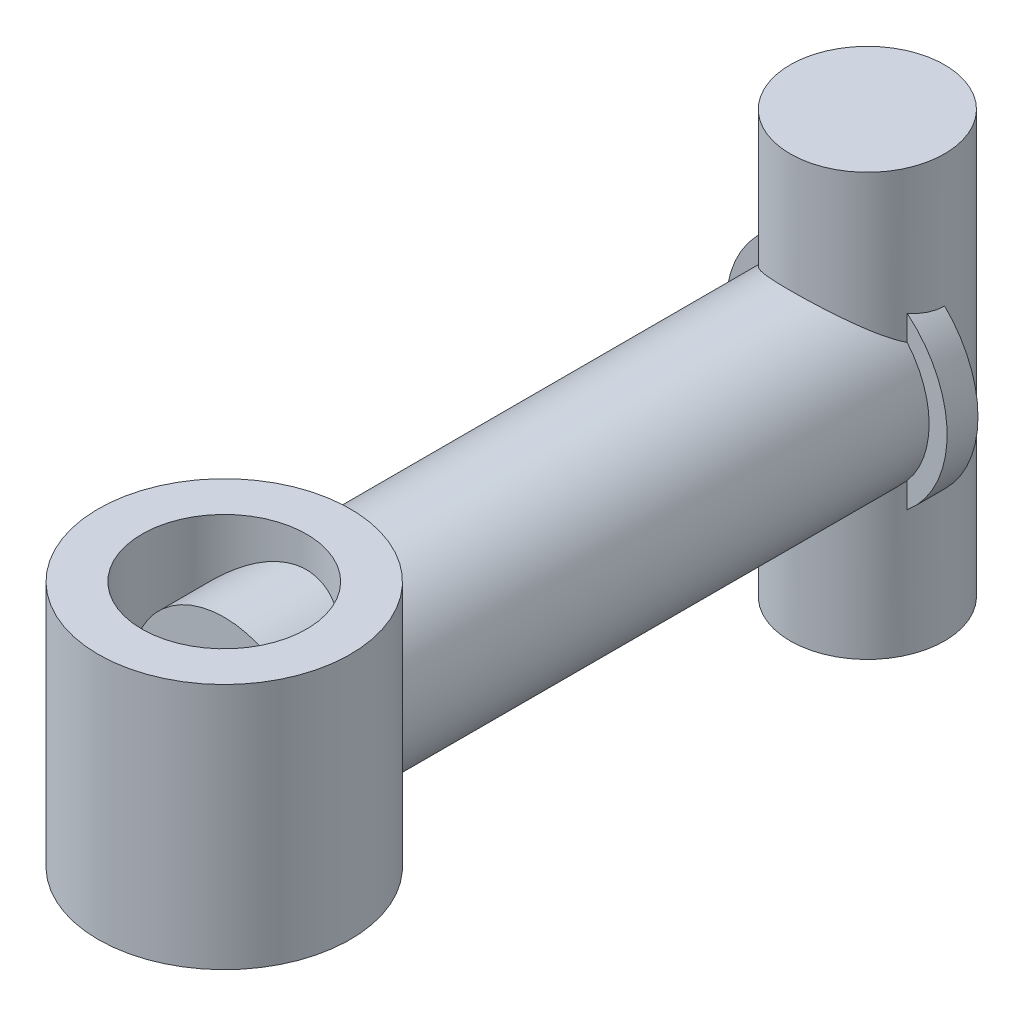
from build123d import *

# Parameters (mm, degrees)
EXTRUDE_1_DEPTH      = 82
EXTRUDE_1_DEPTH_BACK = 82
SKETCH_1_R           = 30
SKETCH_2_R           = 43
EXTRUDE_2_DEPTH      = 12
SKETCH_3_R           = 36
EXTRUDE_3_DEPTH      = 250
EXTRUDE_5_DEPTH      = 48
EXTRUDE_5_DEPTH_BACK = 48
SKETCH_5_R           = 49
SKETCH_5_R_2         = 32


with BuildPart() as part:
    # 草图1 → 凸台-拉伸1 (new, two sides: drawn at the far end of the back side and taken through both)
    with BuildSketch(Plane(origin=(0, 0, 0), x_dir=(1, 0, 0), z_dir=(0, 1, 0)).offset(-EXTRUDE_1_DEPTH_BACK)):
        Circle(SKETCH_1_R)
    extrude(amount=EXTRUDE_1_DEPTH + EXTRUDE_1_DEPTH_BACK)

    # 草图2 → 凸台-拉伸2 (add)
    with BuildSketch(Plane.XY):
        Circle(SKETCH_2_R)
    extrude(amount=EXTRUDE_2_DEPTH)

    # 草图3 → 凸台-拉伸3 (add)
    with BuildSketch(Plane.XY):
        Circle(SKETCH_3_R)
    extrude(amount=EXTRUDE_3_DEPTH)

    # 草图5 → 凸台-拉伸5 (add, two sides: drawn at the far end of the back side and taken through both)
    with BuildSketch(Plane(origin=(0, 0, 0), x_dir=(1, 0, 0), z_dir=(0, 1, 0)).offset(-EXTRUDE_5_DEPTH_BACK)):
        with Locations((0, -250)):
            Circle(SKETCH_5_R)
        with Locations((0, -250)):
            Circle(SKETCH_5_R_2, mode=Mode.SUBTRACT)
    extrude(amount=EXTRUDE_5_DEPTH + EXTRUDE_5_DEPTH_BACK)


solid = part.part
